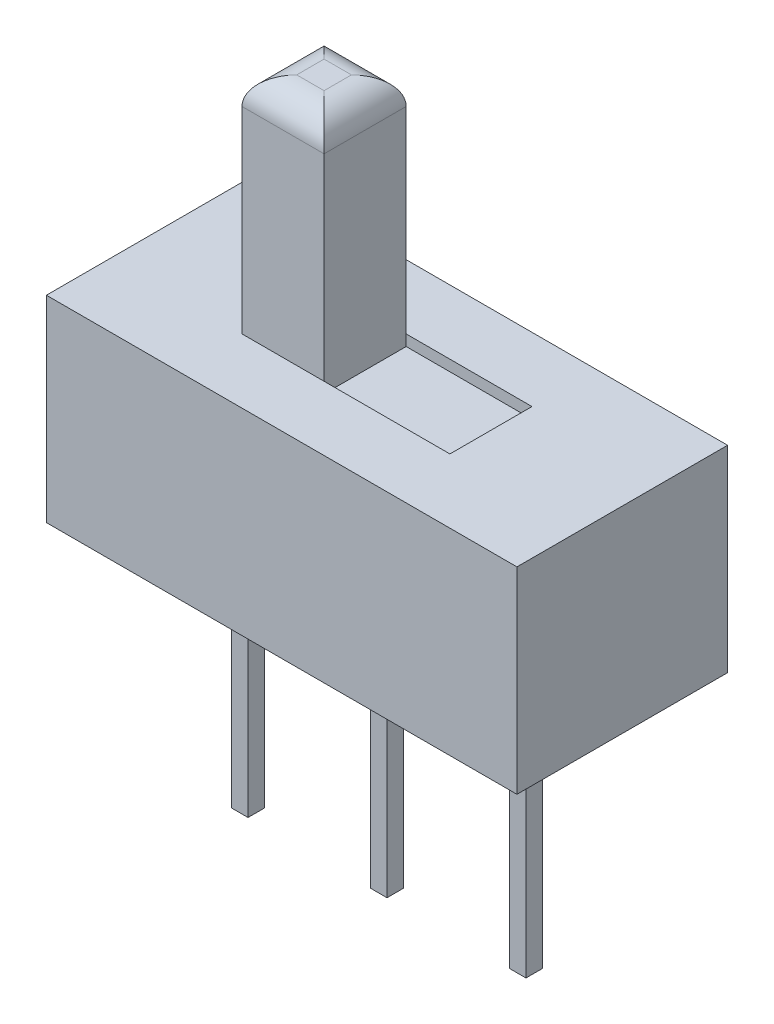
from build123d import *

# Parameters (mm, degrees)
SKETCH2_W           = 8.6
SKETCH2_H           = 3.85
BOSS_EXTRUDE1_DEPTH = 3.6
SKETCH3_W           = 1.5
SKETCH3_H           = 1.5
BOSS_EXTRUDE2_DEPTH = 4.1
SKETCH4_W           = 2.3
SKETCH4_H           = 1.5
CUT_EXTRUDE1_DEPTH  = 0.2
FILLET1_R           = 0.5
SKETCH5_W           = 0.3
SKETCH5_H           = 0.3
BOSS_EXTRUDE3_DEPTH = 4.6


with BuildPart() as part:
    # Sketch2 → Boss-Extrude1 (new body)
    with BuildSketch(Plane(origin=(0, 0, 0), x_dir=(1, 0, 0), z_dir=(0, 1, 0))):
        Rectangle(SKETCH2_W, SKETCH2_H)
    extrude(amount=BOSS_EXTRUDE1_DEPTH)

    # Sketch3 → Boss-Extrude2 (add)
    with BuildSketch(Plane(origin=(0, 3.6, 0), x_dir=(1, 0, 0), z_dir=(0, 1, 0))):
        with Locations((-1.15, 0)):
            Rectangle(SKETCH3_W, SKETCH3_H)
    extrude(amount=BOSS_EXTRUDE2_DEPTH)

    # Sketch4 → Cut-Extrude1 (cut)
    with BuildSketch(Plane(origin=(0, 3.6, 0), x_dir=(1, 0, 0), z_dir=(0, 1, 0))):
        with Locations((0.75, 0)):
            Rectangle(SKETCH4_W, SKETCH4_H)
    extrude(amount=-CUT_EXTRUDE1_DEPTH, mode=Mode.SUBTRACT)

    # Fillet1
    fillet1_edges = [part.edges().sort_by_distance(p)[0] for p in [
        (-0.4, 7.7, 0),
        (-1.15, 7.7, -0.75),
        (-1.9, 7.7, 0),
        (-1.15, 7.7, 0.75),
    ]]
    fillet(fillet1_edges, radius=FILLET1_R)

    # Sketch5 → Boss-Extrude3 (add)
    with BuildSketch(Plane.XZ):
        Rectangle(SKETCH5_W, SKETCH5_H)
        with Locations((-2.54, 0)):
            Rectangle(SKETCH5_W, SKETCH5_H)
        with Locations((2.54, 0)):
            Rectangle(SKETCH5_W, SKETCH5_H)
    extrude(amount=BOSS_EXTRUDE3_DEPTH)


solid = part.part
